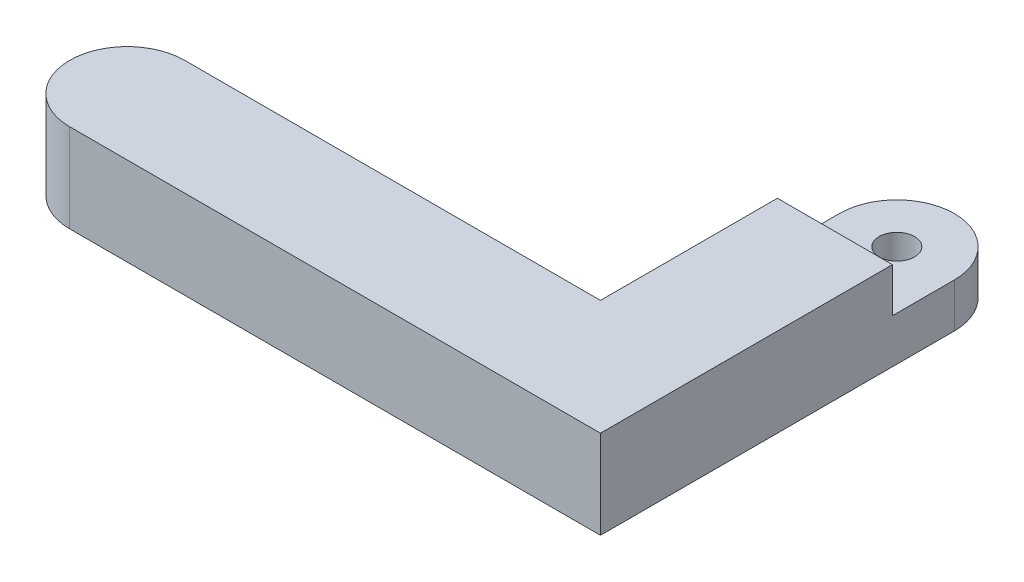
from build123d import *

# Parameters (mm, degrees)
CROQUIS1_R              = 2
SALIENTE_EXTRUIR1_DEPTH = 10
CORTAR_EXTRUIR1_START   = -5
CROQUIS2_R              = 2
CORTAR_EXTRUIR1_DEPTH   = 5


with BuildPart() as part:
    # Croquis1 → Saliente-Extruir1 (new body)
    with BuildSketch(Plane(origin=(0, 0, 0), x_dir=(1, 0, 0), z_dir=(0, 1, 0))):
        with BuildLine():
            Line((13, 0), (13, -40))
            Line((13, -40), (-47, -40))
            ThreePointArc((-47, -40), (-53.5, -33.5), (-47, -27))
            Line((-47, -27), (0, -27))
            Line((0, -27), (0, 0))
            ThreePointArc((0, 0), (6.5, 6.5), (13, 0))
        make_face()
        with Locations(Location((6.5, 0, 0), (0, 0, 270))):
            Circle(CROQUIS1_R, mode=Mode.SUBTRACT)
    extrude(amount=SALIENTE_EXTRUIR1_DEPTH)

    # Croquis2 → Cortar-Extruir1 (cut)
    with BuildSketch(Plane(origin=(0, 10, 0), x_dir=(1, 0, 0), z_dir=(0, 1, 0)).offset(CORTAR_EXTRUIR1_START)):
        with BuildLine():
            Line((0, 0), (0, -7))
            Line((0, -7), (13, -7))
            Line((13, -7), (13, 0))
            ThreePointArc((13, 0), (6.5, 6.5), (0, 0))
        make_face()
        with Locations(Location((6.5, 0, 0), (0, 0, 270))):
            Circle(CROQUIS2_R, mode=Mode.SUBTRACT)
    extrude(amount=CORTAR_EXTRUIR1_DEPTH, mode=Mode.SUBTRACT)


solid = part.part
